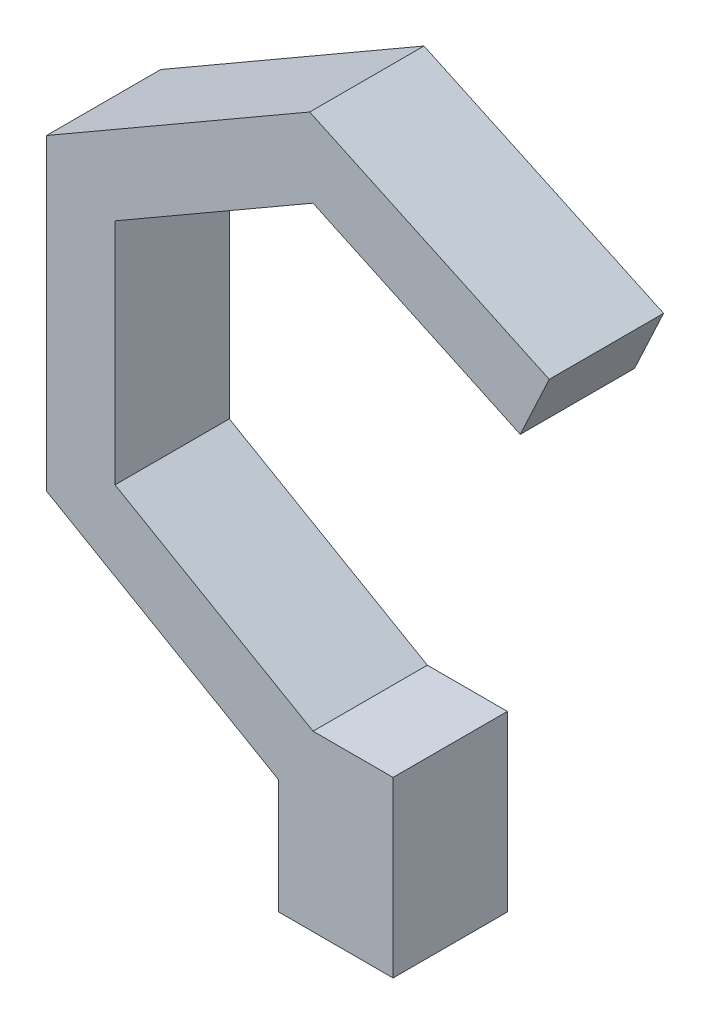
from build123d import *

# Parameters (mm, degrees)
BOSS_EXTRUDE1_DEPTH = 12.7


with BuildPart() as part:
    # Sketch2 → Boss-Extrude1 (new body)
    with BuildSketch(Plane.XY):
        Polygon((0, -25.4), (-21.997045256, -12.7), (-21.997045256, 12.7), (0, 25.4), (23.020217791, 14.665496152), (26.240568945, 21.571561489), (-0.374718909, 33.982474039), (-29.617045256, 17.099409051), (-29.617045256, -17.099409051), (-3.81, -31.999113577), (-3.81, -44.699113577), (8.89, -44.699113577), (8.89, -25.4), align=None)
    extrude(amount=BOSS_EXTRUDE1_DEPTH)


solid = part.part
